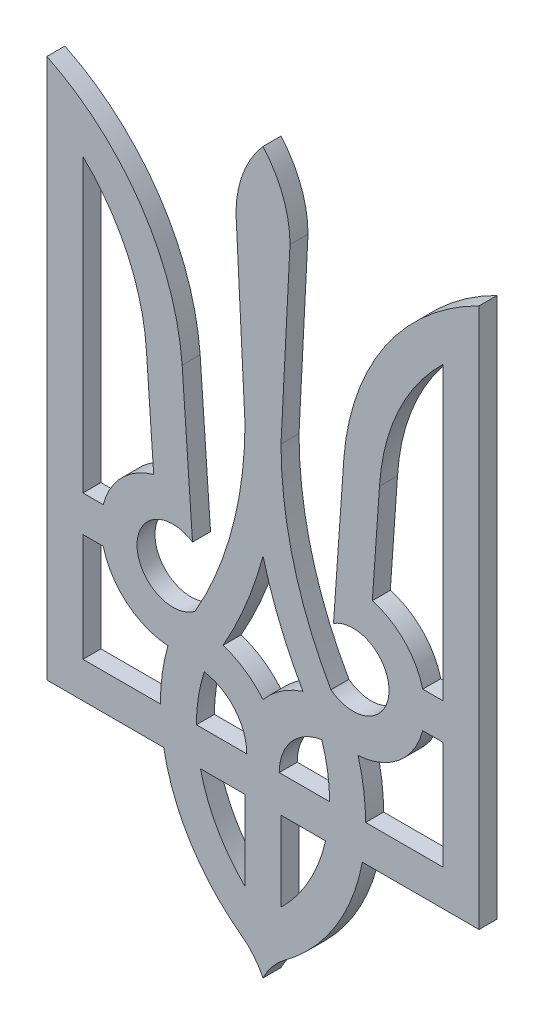
from build123d import *

# Parameters (mm, degrees)
EXTRUDE_1_DEPTH = 5
SCALE_1_SCALE   = 0.6


with BuildPart() as part:
    # Эскиз1 → Бобышка-Вытянуть1 (new body)
    with BuildSketch(Plane.XY):
        with BuildLine():
            Line((5, 29.434281034), (7.5, 78.684281034))
            ThreePointArc((7.5, 78.684281034), (5.562430401, 89.290882752), (0, 98.527415867))
            ThreePointArc((0, 98.527415867), (-5.562430401, 89.290882752), (-7.5, 78.684281034))
            Line((-7.5, 78.684281034), (-5, 29.434281034))
            ThreePointArc((-5, 29.434281034), (-8.525159088, 2.45546227), (-18.863936417, -22.711839767))
            ThreePointArc((-18.863936417, -22.711839767), (-34.990467135, -15.25225811), (-19.576058944, -6.414477187))
            Line((-19.576058944, -6.414477187), (-22.449472465, 34.677250594))
            ThreePointArc((-22.449472465, 34.677250594), (-33.881518529, 67.398455427), (-60, 90.184281034))
            Line((-60, 90.184281034), (-60, -59.815718966))
            Line((-60, -59.815718966), (-27.583269132, -59.815718966))
            ThreePointArc((-27.583269132, -59.815718966), (-20.06001769, -79.093095091), (-5.945767968, -94.225989636))
            ThreePointArc((-5.945767968, -94.225989636), (-2.542345747, -97.496033993), (0, -101.472584133))
            ThreePointArc((0, -101.472584133), (2.542345747, -97.496033993), (5.945767968, -94.225989636))
            ThreePointArc((5.945767968, -94.225989636), (20.06001769, -79.093095091), (27.583269132, -59.815718966))
            Line((27.583269132, -59.815718966), (60, -59.815718966))
            Line((60, -59.815718966), (60, 90.184281034))
            ThreePointArc((60, 90.184281034), (33.881518529, 67.398455427), (22.449472466, 34.677250594))
            Line((22.449472466, 34.677250594), (19.576058945, -6.414477187))
            ThreePointArc((19.576058945, -6.414477187), (34.990467135, -15.25225811), (18.863936417, -22.711839767))
            ThreePointArc((18.863936417, -22.711839767), (8.525159088, 2.45546227), (5, 29.434281034))
        make_face()
        with BuildLine():
            Line((18.5, -49.815718966), (4.5, -49.815718966))
            ThreePointArc((4.5, -49.815718966), (7.858362699, -40.718710911), (16.322222222, -35.986138931))
            ThreePointArc((16.322222222, -35.986138931), (17.952221542, -42.815718966), (18.5, -49.815718966))
        make_face(mode=Mode.SUBTRACT)
        with BuildLine():
            Line((5, -59.815718966), (17.374821937, -59.815718966))
            ThreePointArc((17.374821937, -59.815718966), (12.779082294, -71.773717375), (5, -81.952146894))
            Line((5, -81.952146894), (5, -59.815718966))
        make_face(mode=Mode.SUBTRACT)
        with BuildLine():
            Line((28.5, -49.815718966), (50, -49.815718966))
            Line((50, -49.815718966), (50, -19.815718966))
            Line((50, -19.815718966), (44.364916731, -19.815718966))
            ThreePointArc((44.364916731, -19.815718966), (37.794087282, -30.18814007), (26.401072965, -34.766583472))
            ThreePointArc((26.401072965, -34.766583472), (27.972740949, -42.218318526), (28.5, -49.815718966))
        make_face(mode=Mode.SUBTRACT)
        with BuildLine():
            Line((44.364916731, -9.815718966), (50, -9.815718966))
            Line((50, -9.815718966), (50, 71.093478113))
            ThreePointArc((50, 71.093478113), (37.591425702, 53.700101468), (32.355603325, 32.985651651))
            Line((32.355603325, 32.985651651), (30.360374841, 4.452554998))
            ThreePointArc((30.360374841, 4.452554998), (39.273434111, -0.806112309), (44.364916731, -9.815718966))
        make_face(mode=Mode.SUBTRACT)
        with BuildLine():
            Line((-44.364916731, -19.815718966), (-50, -19.815718966))
            Line((-50, -19.815718966), (-50, -49.815718966))
            Line((-50, -49.815718966), (-28.5, -49.815718966))
            ThreePointArc((-28.5, -49.815718966), (-27.972740949, -42.218318526), (-26.401072965, -34.766583472))
            ThreePointArc((-26.401072965, -34.766583472), (-37.794087282, -30.18814007), (-44.364916731, -19.815718966))
        make_face(mode=Mode.SUBTRACT)
        with BuildLine():
            Line((-5, -81.952146894), (-5, -59.815718966))
            Line((-5, -59.815718966), (-17.374821937, -59.815718966))
            ThreePointArc((-17.374821937, -59.815718966), (-12.779082294, -71.773717375), (-5, -81.952146894))
        make_face(mode=Mode.SUBTRACT)
        with BuildLine():
            Line((-50, -9.815718966), (-50, 71.093478113))
            ThreePointArc((-50, 71.093478113), (-37.591425702, 53.700101468), (-32.355603325, 32.985651651))
            Line((-32.355603325, 32.985651651), (-30.360374841, 4.452554998))
            ThreePointArc((-30.360374841, 4.452554998), (-39.273434111, -0.806112309), (-44.364916731, -9.815718966))
            Line((-44.364916731, -9.815718966), (-50, -9.815718966))
        make_face(mode=Mode.SUBTRACT)
        with BuildLine():
            Line((-18.5, -49.815718966), (-4.5, -49.815718966))
            ThreePointArc((-4.5, -49.815718966), (-7.858362699, -40.718710911), (-16.322222222, -35.986138931))
            ThreePointArc((-16.322222222, -35.986138931), (-17.952221542, -42.815718966), (-18.5, -49.815718966))
        make_face(mode=Mode.SUBTRACT)
        with BuildLine():
            ThreePointArc((11.091351129, -26.987842983), (5.008387109, -29.966880672), (0, -34.526834114))
            ThreePointArc((0, -34.526834114), (-5.008387109, -29.966880672), (-11.091351129, -26.987842983))
            ThreePointArc((-11.091351129, -26.987842983), (-4.677676581, -13.850648093), (0, 0))
            ThreePointArc((0, 0), (4.677676581, -13.850648093), (11.091351129, -26.987842983))
        make_face(mode=Mode.SUBTRACT)
    extrude(amount=EXTRUDE_1_DEPTH)


with BuildPart() as part_1:
    # Масштаб1: scaled about (0, -2.486348983, 2.5)
    add(part.part.scale(SCALE_1_SCALE).moved(Location((0, -0.994539593, 1))))


solid = part_1.part
